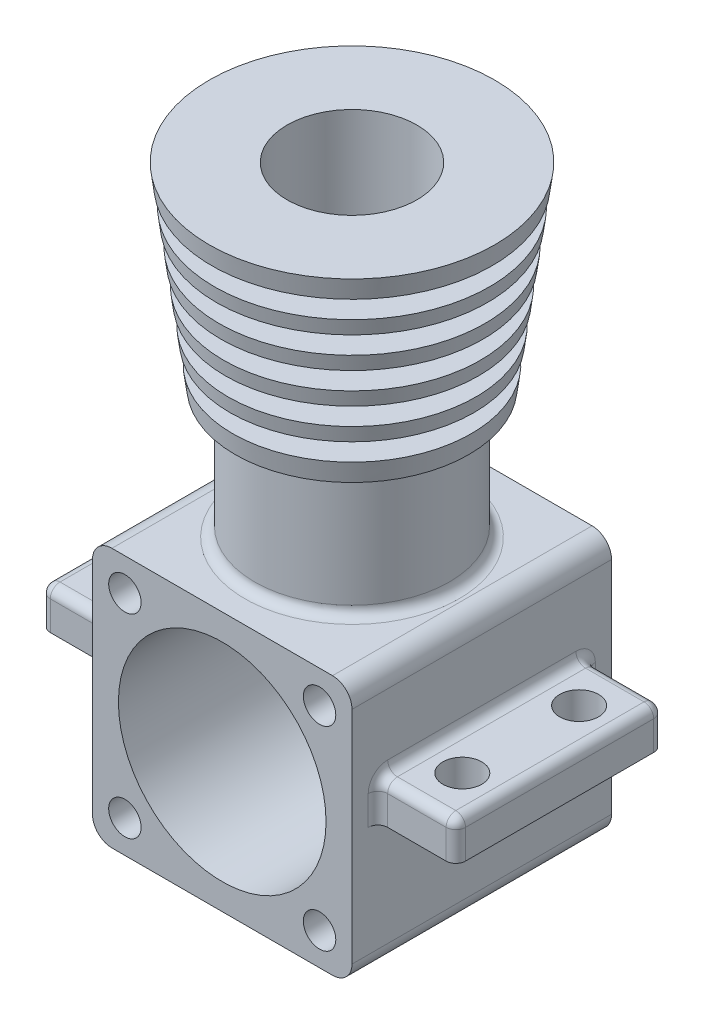
from build123d import *

# Parameters (mm, degrees)
SKETCH1_W               = 40
SKETCH1_H               = 40
SKETCH1_R               = 2.5
SKETCH1_R_2             = 16
BOSS_EXTRUDE2_DEPTH     = 20
FILLET2_R               = 3
SKETCH3_W               = 18
SKETCH3_H               = 3
LPATTERN1_COUNT         = 5
LPATTERN1_PITCH         = 5.25
CUT_EXTRUDE2_REACH      = 97.226
CUT_EXTRUDE2_END_RADIUS = 16
SKETCH6_R               = 10
SKETCH7_W               = 12
SKETCH7_H               = 32
SKETCH7_R               = 3
BOSS_EXTRUDE4_DEPTH     = 6
FILLET3_R               = 1.5


with BuildPart() as part:
    # Sketch1 → Boss-Extrude2 (new, symmetric)
    with BuildSketch(Plane.XY):
        Rectangle(SKETCH1_W, SKETCH1_H)
        with Locations((-15, 15)):
            Circle(SKETCH1_R, mode=Mode.SUBTRACT)
        with Locations((15, 15)):
            Circle(SKETCH1_R, mode=Mode.SUBTRACT)
        with Locations((15, -15)):
            Circle(SKETCH1_R, mode=Mode.SUBTRACT)
        with Locations((-15, -15)):
            Circle(SKETCH1_R, mode=Mode.SUBTRACT)
        Circle(SKETCH1_R_2, mode=Mode.SUBTRACT)
    extrude(amount=BOSS_EXTRUDE2_DEPTH, both=True)

    # Fillet2
    fillet2_edges = [part.edges().sort_by_distance(p)[0] for p in [
        (20, -20, 0),
        (-20, -20, 0),
        (-20, 20, 0),
        (20, 20, 0),
    ]]
    fillet(fillet2_edges, radius=FILLET2_R)

    # Sketch2 → Revolve1 (revolve)
    with BuildSketch(Plane.XY, mode=Mode.PRIVATE) as revolve1_sk:
        Polygon((0, 20), (0, 70), (-22, 70), (-18, 40), (-15, 40), (-15, 20), align=None)
    revolve(revolve1_sk.sketch.rotate(Axis((0, 20, 0), (0, 1, 0)), 180), axis=Axis((0, 20, 0), (0, 1, 0)))

    # Sketch3 → Cut-Revolve1 (revolve, cut)
    with BuildSketch(Plane.XY, mode=Mode.PRIVATE) as cut_revolve1_sk:
        with Locations((-21, 44.5)):
            Rectangle(SKETCH3_W, SKETCH3_H)
    cut_revolve1 = revolve(cut_revolve1_sk.sketch.rotate(Axis((0, 34.204860636, 0), (0, 1, 0)), 270), axis=Axis((0, 34.204860636, 0), (0, 1, 0)), mode=Mode.SUBTRACT)

    # LPattern1: Cut-Revolve1 ×5
    with Locations(*[(0, i * LPATTERN1_PITCH, 0) for i in range(1, LPATTERN1_COUNT)]):
        add(cut_revolve1, mode=Mode.SUBTRACT)

    # Cut-Extrude2: up to this cylinder (the profile starts outside it)
    cut_extrude2_end = Plane(origin=(0, 0, 0), z_dir=(0, 0, -1)) * Cylinder(CUT_EXTRUDE2_END_RADIUS, 227.452, mode=Mode.PRIVATE)
    # Sketch6 → Cut-Extrude2 (cut, up to the surface)
    with BuildSketch(Plane(origin=(0, 70, 0), x_dir=(1, 0, 0), z_dir=(0, 1, 0)), mode=Mode.PRIVATE) as cut_extrude2_sk1:
        with Locations(Location((0, 0, 0), (0, 0, 180))):
            Circle(SKETCH6_R)
    cut_extrude2_tool1 = extrude(cut_extrude2_sk1.sketch, amount=-CUT_EXTRUDE2_REACH, mode=Mode.PRIVATE) - cut_extrude2_end
    add(cut_extrude2_tool1.solids().sort_by_distance((0, 70, 0))[0], mode=Mode.SUBTRACT)

    # Sketch7 → Boss-Extrude4 (add)
    with BuildSketch(Plane(origin=(0, 0, 0), x_dir=(1, 0, 0), z_dir=(0, 1, 0))):
        with Locations((-26, 0)):
            Rectangle(SKETCH7_W, SKETCH7_H)
        with Locations(Location((-26, 9, 0), (0, 0, 270))):
            Circle(SKETCH7_R, mode=Mode.SUBTRACT)
        with Locations(Location((-26, -9, 0), (0, 0, 270))):
            Circle(SKETCH7_R, mode=Mode.SUBTRACT)
    boss_extrude4 = extrude(amount=BOSS_EXTRUDE4_DEPTH)

    # Mirror1: Boss-Extrude4 across plane
    add(boss_extrude4.mirror(Plane(origin=(0, 0, 0), x_dir=(0, 0, 1), z_dir=(1, 0, 0))))

    # Fillet3
    fillet3_edges = [part.edges().sort_by_distance(p)[0] for p in [
        (-20, 6, 0),
        (-26, 6, -16),
        (-32, 6, 0),
        (-26, 6, 16),
        (-20, 3, 16),
        (-20, 3, -16),
        (-32, 3, -16),
        (-32, 3, 16),
        (20, 6, 0),
        (20, 3, -16),
        (26, 6, 16),
        (20, 3, 16),
        (32, 6, 0),
        (32, 3, 16),
        (26, 6, -16),
        (32, 3, -16),
        (-15, 20, 0),
    ]]
    fillet(fillet3_edges, radius=FILLET3_R)


solid = part.part
